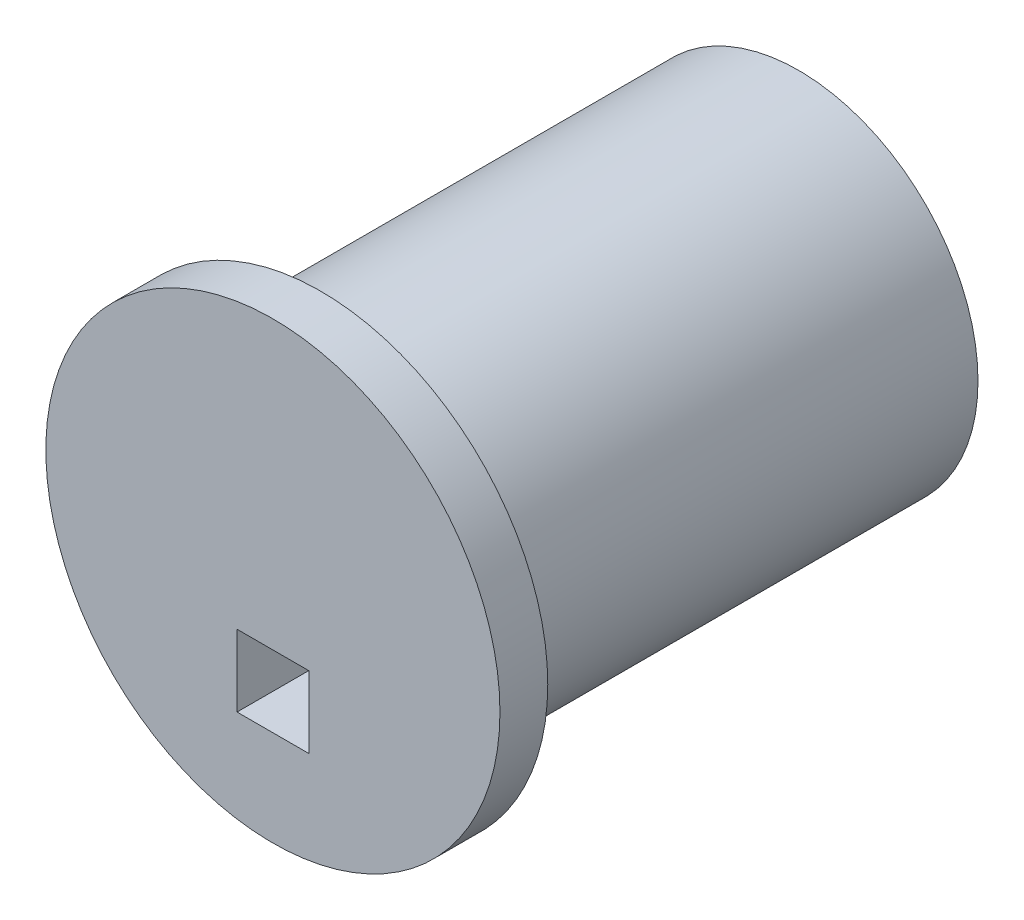
from build123d import *

# Parameters (mm, degrees)
SKETCH1_R           = 7.5
BOSS_EXTRUDE1_DEPTH = 22
SKETCH4_W           = 3
SKETCH4_H           = 3
CUT_EXTRUDE1_DEPTH  = 10
SKETCH5_R           = 1.5
CUT_EXTRUDE2_DEPTH  = 5
CIRPATTERN1_COUNT   = 4
BOSS_EXTRUDE2_START = -2
SKETCH6_R           = 9.5
SKETCH6_R_2         = 7.5
BOSS_EXTRUDE2_DEPTH = 2


with BuildPart() as part:
    # Sketch1 → Boss-Extrude1 (new body)
    with BuildSketch(Plane.XY):
        Circle(SKETCH1_R)
    extrude(amount=BOSS_EXTRUDE1_DEPTH)

    # Sketch4 → Cut-Extrude1 (cut)
    with BuildSketch(Plane.XY.offset(22)):
        with Locations((0, -4)):
            Rectangle(SKETCH4_W, SKETCH4_H)
    extrude(amount=-CUT_EXTRUDE1_DEPTH, mode=Mode.SUBTRACT)

    # Sketch5 → Cut-Extrude2 (cut)
    with BuildSketch(Plane(origin=(0, 0, 0), x_dir=(-1, 0, 0), z_dir=(0, 0, -1))):
        with Locations((0, 4)):
            Circle(SKETCH5_R)
    cut_extrude2 = extrude(amount=-CUT_EXTRUDE2_DEPTH, mode=Mode.SUBTRACT)

    # CirPattern1: Cut-Extrude2 ×4 about axis
    cirpattern1_axis = Axis((0, 0, 0), (0, 0, 1))
    for i in range(1, CIRPATTERN1_COUNT):
        add(cut_extrude2.rotate(cirpattern1_axis, i * 360 / CIRPATTERN1_COUNT), mode=Mode.SUBTRACT)

    # Sketch6 → Boss-Extrude2 (add)
    with BuildSketch(Plane.XY.offset(22).offset(BOSS_EXTRUDE2_START)):
        Circle(SKETCH6_R)
        Circle(SKETCH6_R_2, mode=Mode.SUBTRACT)
    extrude(amount=BOSS_EXTRUDE2_DEPTH)


solid = part.part
